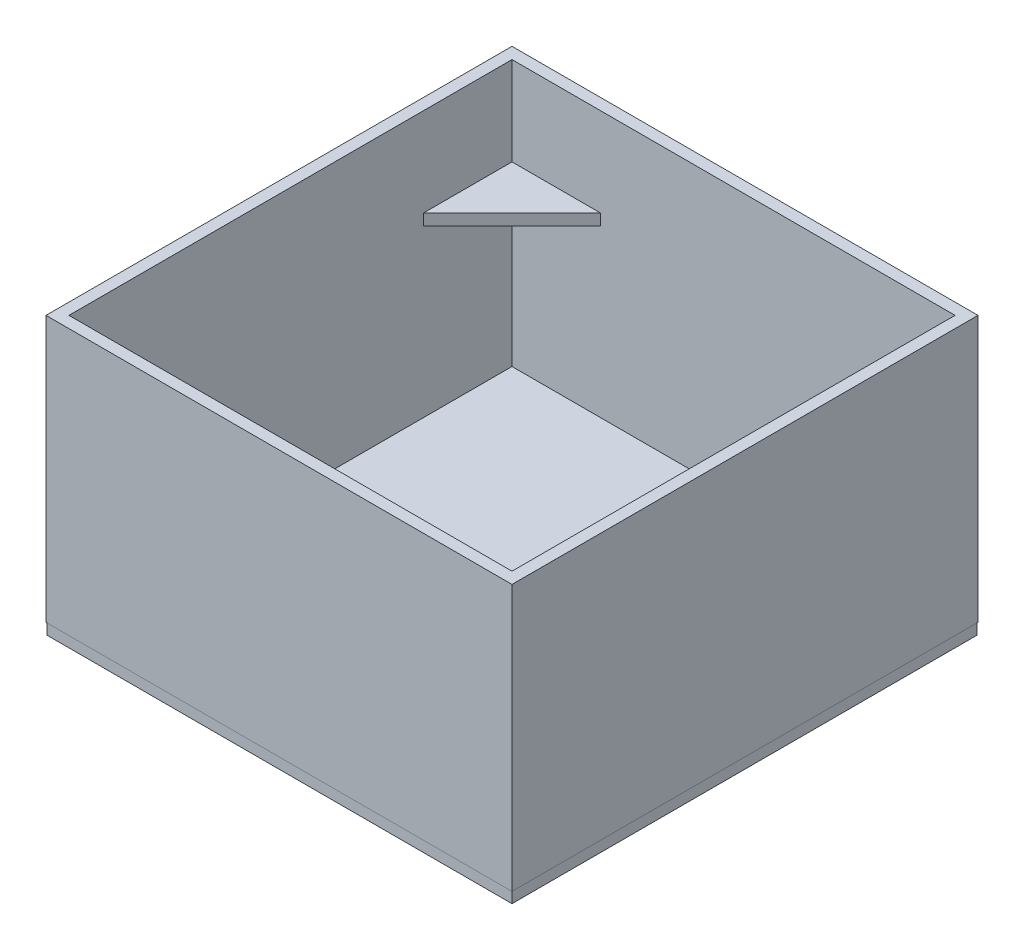
from build123d import *

# Parameters (mm, degrees)
SKETCH1_W           = 133.35
SKETCH1_H           = 133.35
BOSS_EXTRUDE2_DEPTH = 3.175
SKETCH2_W           = 133.579746761
SKETCH2_H           = 133.57974676
SKETCH2_W_2         = 127
SKETCH2_H_2         = 127
EXTRUDE_THIN1_DEPTH = 76.2
BOSS_EXTRUDE3_START = -25.4
BOSS_EXTRUDE3_DEPTH = 3.175


with BuildPart() as part:
    # Sketch1 → Boss-Extrude2 (new body)
    with BuildSketch(Plane(origin=(0, 0, 0), x_dir=(1, 0, 0), z_dir=(0, 1, 0))):
        with Locations((-10.590734266, 10.501923077)):
            Rectangle(SKETCH1_W, SKETCH1_H)
    extrude(amount=BOSS_EXTRUDE2_DEPTH)

    # Sketch2 → Extrude-Thin1 (add)
    with BuildSketch(Plane(origin=(0, 3.175, 0), x_dir=(1, 0, 0), z_dir=(0, 1, 0))):
        with Locations((-10.590734266, 10.501923077)):
            Rectangle(SKETCH2_W, SKETCH2_H)
        with Locations((-10.590734266, 10.501923077)):
            Rectangle(SKETCH2_W_2, SKETCH2_H_2, mode=Mode.SUBTRACT)
    extrude(amount=EXTRUDE_THIN1_DEPTH)

    # Sketch4 → Boss-Extrude3 (add)
    with BuildSketch(Plane(origin=(0, 79.375, 0), x_dir=(1, 0, 0), z_dir=(0, 1, 0)).offset(BOSS_EXTRUDE3_START)):
        Polygon((-48.690734266, 74.001923077), (-74.090734266, 48.601923077), (-74.090734266, 74.001923077), align=None)
        Polygon((-74.090734266, -52.998076923), (-74.090734266, -27.598076923), (-48.690734266, -52.998076923), align=None)
        Polygon((52.909265734, 74.001923077), (27.509265734, 74.001923077), (52.909265734, 48.601923077), align=None)
        Polygon((52.909265734, -52.998076923), (52.909265734, -27.598076923), (27.509265734, -52.998076923), align=None)
    extrude(amount=-BOSS_EXTRUDE3_DEPTH)


solid = part.part
